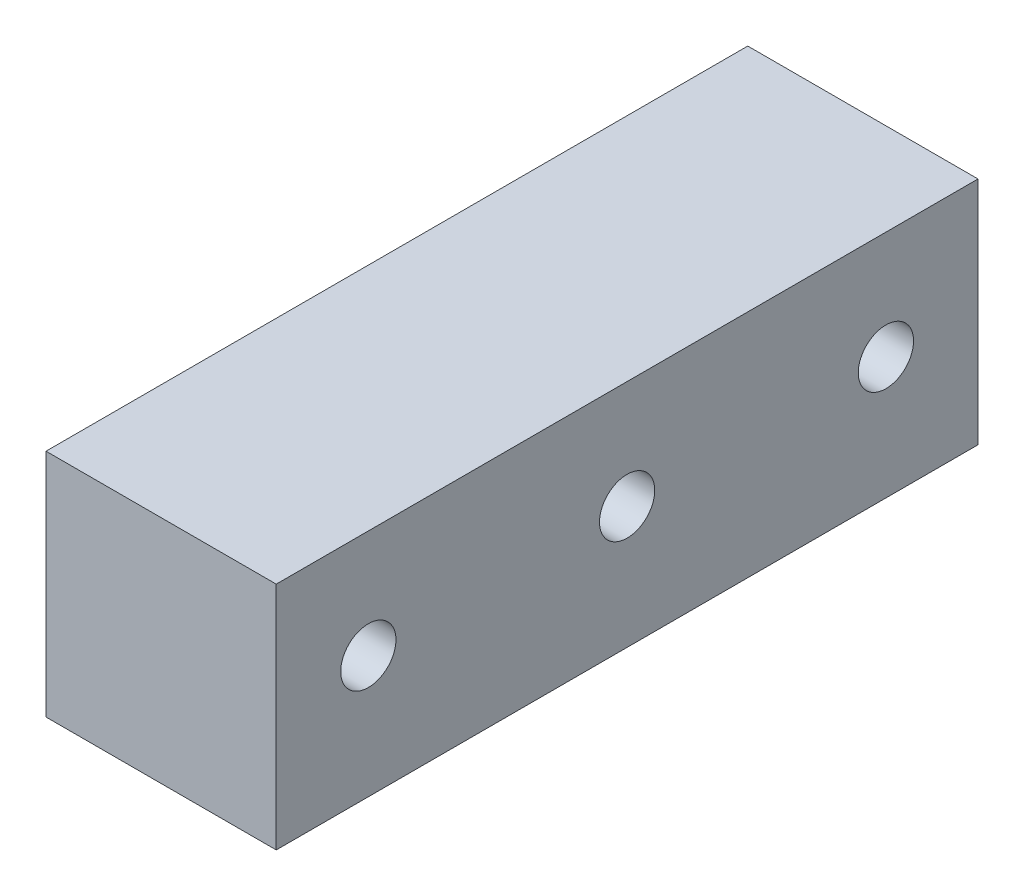
from build123d import *

# Parameters (mm, degrees)
SKETCH1_W           = 50
SKETCH1_H           = 152.4
BOSS_EXTRUDE1_DEPTH = 50
SKETCH2_R           = 6
CUT_EXTRUDE1_DEPTH  = 104.954028301


with BuildPart() as part:
    # Sketch1 → Boss-Extrude1 (new body)
    with BuildSketch(Plane(origin=(0, 0, 0), x_dir=(1, 0, 0), z_dir=(0, 1, 0))):
        Rectangle(SKETCH1_W, SKETCH1_H)
    extrude(amount=BOSS_EXTRUDE1_DEPTH)

    # Sketch2 → Cut-Extrude1 (cut, through all)
    with BuildSketch(Plane(origin=(25, 0, 0), x_dir=(0, 0, -1), z_dir=(1, 0, 0))):
        with Locations((-56.2, 26.550494935)):
            Circle(SKETCH2_R)
        with Locations((0, 26.550494935)):
            Circle(SKETCH2_R)
        with Locations((56.2, 26.550494935)):
            Circle(SKETCH2_R)
    extrude(amount=-CUT_EXTRUDE1_DEPTH, mode=Mode.SUBTRACT)


solid = part.part
